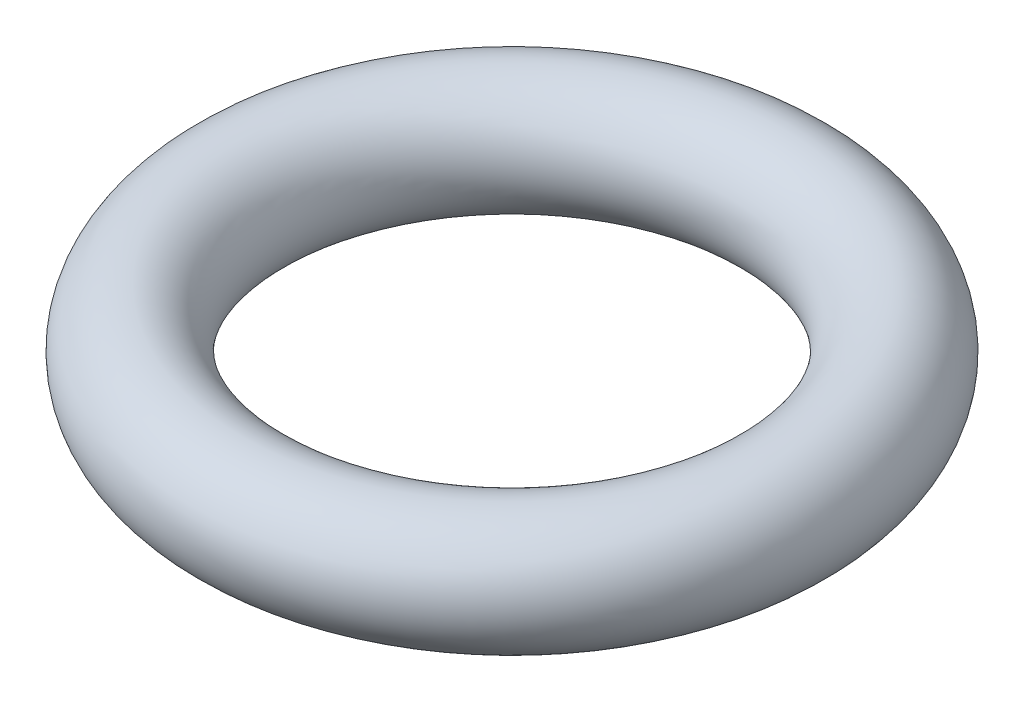
from build123d import *

# Parameters (mm, degrees)
CROQUIS2_R = 0.8


with BuildPart() as part:
    # Barrer1: sweep along a path in Croquis1
    with BuildLine(Plane(origin=(0, 0, 0), x_dir=(1, 0, 0), z_dir=(0, 1, 0))) as barrer1_path:
        CenterArc((0, 0), 3.65, 0, 360)
    # Croquis2 → Barrer1 (sweep)
    with BuildSketch(Plane(origin=(0, 0, 0), x_dir=(0, 0, -1), z_dir=(1, 0, 0))):
        with Locations((3.65, 0)):
            Circle(CROQUIS2_R)
    sweep(path=barrer1_path.line)


solid = part.part
